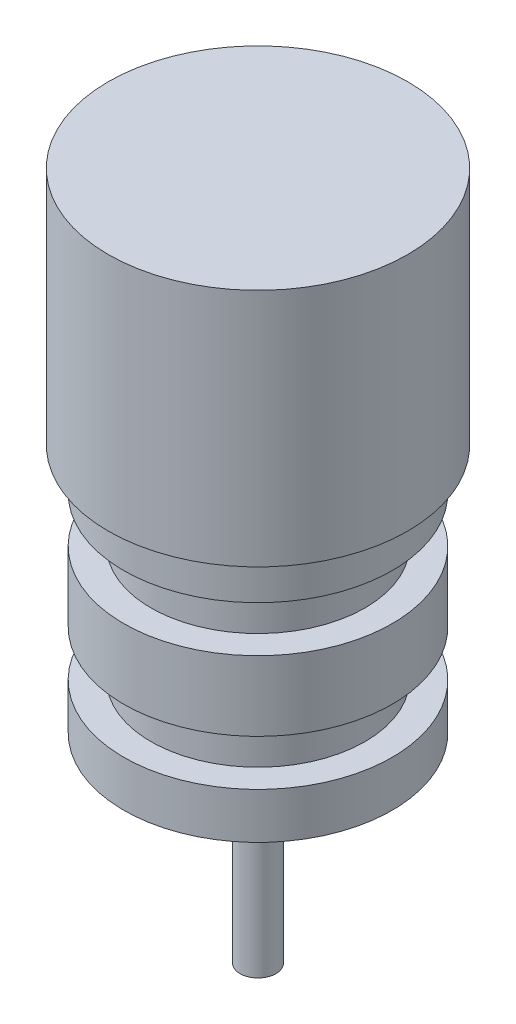
from build123d import *


with BuildPart() as part:
    # Esquisse3 → Révolution1 (revolve)
    with BuildSketch(Plane.XY, mode=Mode.PRIVATE) as r_volution1_sk:
        Polygon((0, -20), (1.8, -20), (1.8, 0), (13.45, 0), (13.45, 4.6), (10.73, 4.6), (10.73, 9.2), (13.45, 9.2), (13.45, 16.2), (10.73, 16.2), (10.73, 20.8), (13.45, 20.8), (13.45, 25), (15, 25), (15, 49), (0, 49), (0, 0), align=None)
    revolve(r_volution1_sk.sketch.rotate(Axis((0, 49, 0), (0, -1, 0)), 180), axis=Axis((0, 49, 0), (0, -1, 0)))


solid = part.part
